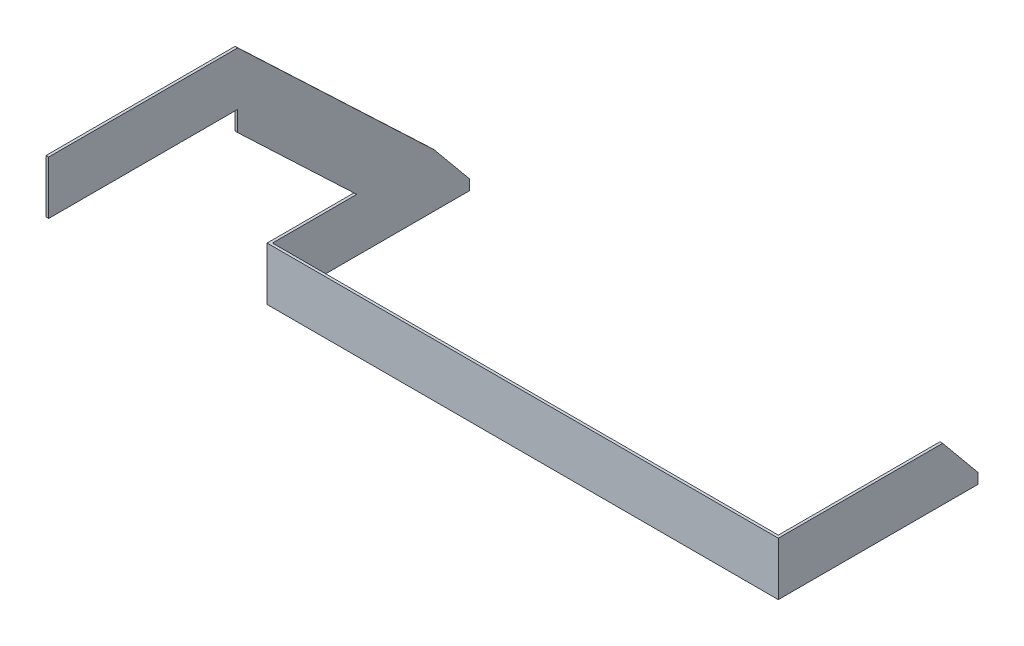
from build123d import *

# Parameters (mm, degrees)
CROQUIS1_W              = 1
CROQUIS1_H              = 74
CROQUIS1_H_2            = 1
CROQUIS1_W_2            = 190
SALIENTE_EXTRUIR1_DEPTH = 20
SALIENTE_EXTRUIR2_DEPTH = 1
CORTAR_EXTRUIR1_DEPTH   = 225.75375414
CROQUIS4_W              = 71
CROQUIS4_H              = 20
SALIENTE_EXTRUIR3_DEPTH = 1


with BuildPart() as part:
    # Croquis1 → Saliente-Extruir1 (new body)
    with BuildSketch(Plane(origin=(0, 0, 0), x_dir=(1, 0, 0), z_dir=(0, 1, 0))):
        with Locations((-95.5, 37.5)):
            Rectangle(CROQUIS1_W, CROQUIS1_H)
        with Locations((-95.5, 0)):
            Rectangle(CROQUIS1_W, CROQUIS1_H_2)
        Rectangle(CROQUIS1_W_2, CROQUIS1_H_2)
        with Locations((95.5, 37.5)):
            Rectangle(CROQUIS1_W, CROQUIS1_H)
        with Locations((95.5, 0)):
            Rectangle(CROQUIS1_W, CROQUIS1_H_2)
    extrude(amount=SALIENTE_EXTRUIR1_DEPTH)

    # Croquis2 → Saliente-Extruir2 (add)
    with BuildSketch(Plane.ZY.offset(96)):
        Polygon((12.544924521, 90), (-61.219684248, 20), (-32.164890823, 20), (12.544924521, 62.428030546), align=None)
        Polygon((-61.219684248, 20), (-74.5, 7.397450917), (-67.480081196, 0), (-53.240493329, 0), (-32.164890823, 20), align=None)
    extrude(amount=-SALIENTE_EXTRUIR2_DEPTH)

    # Croquis3 → Cortar-Extruir1 (cut, through all)
    with BuildSketch(Plane.ZY.offset(96)):
        Polygon((-61.219684248, 20), (-74.5, 3.892353298), (-74.5, 20), align=None)
    extrude(amount=-CORTAR_EXTRUIR1_DEPTH, mode=Mode.SUBTRACT)

    # Croquis4 → Saliente-Extruir3 (add)
    with BuildSketch(Plane.ZY.offset(96)):
        with Locations((48.044924521, 80)):
            Rectangle(CROQUIS4_W, CROQUIS4_H)
    extrude(amount=-SALIENTE_EXTRUIR3_DEPTH)


solid = part.part
